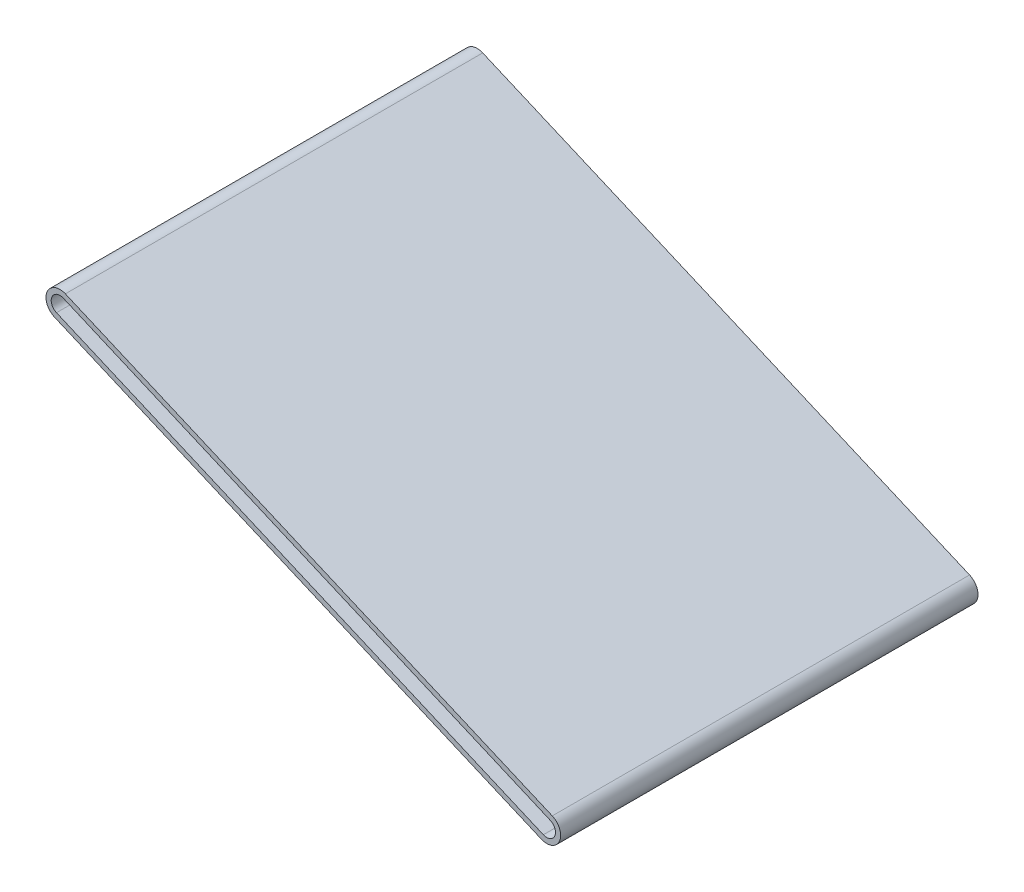
from build123d import *

# Parameters (mm, degrees)
BOSS_EXTRUDE1_DEPTH = 304.8


with BuildPart() as part:
    # Sketch1 → Boss-Extrude1 (new body)
    with BuildSketch(Plane.XY):
        Polygon((-349.09639238, 167.575084446), (6.50360762, 15.175084446), (8.004440147, 18.67702701), (-347.595559853, 171.07702701), align=None)
        Polygon((-354.099167472, 155.901942564), (1.500832528, 3.501942564), (0, 0), (-355.6, 152.4), align=None)
        with BuildLine():
            ThreePointArc((-349.09639238, 167.575084446), (-357.434350867, 164.239901051), (-354.099167472, 155.901942564))
            Line((-354.099167472, 155.901942564), (-355.6, 152.4))
            ThreePointArc((-355.6, 152.4), (-360.936293431, 165.740733579), (-347.595559853, 171.07702701))
            Line((-347.595559853, 171.07702701), (-349.09639238, 167.575084446))
        make_face()
        with BuildLine():
            ThreePointArc((1.500832528, 3.501942564), (9.838791014, 6.837125959), (6.50360762, 15.175084446))
            Line((6.50360762, 15.175084446), (8.004440147, 18.67702701))
            ThreePointArc((8.004440147, 18.67702701), (13.340733579, 5.336293431), (0, 0))
            Line((0, 0), (1.500832528, 3.501942564))
        make_face()
    extrude(amount=BOSS_EXTRUDE1_DEPTH)


solid = part.part
